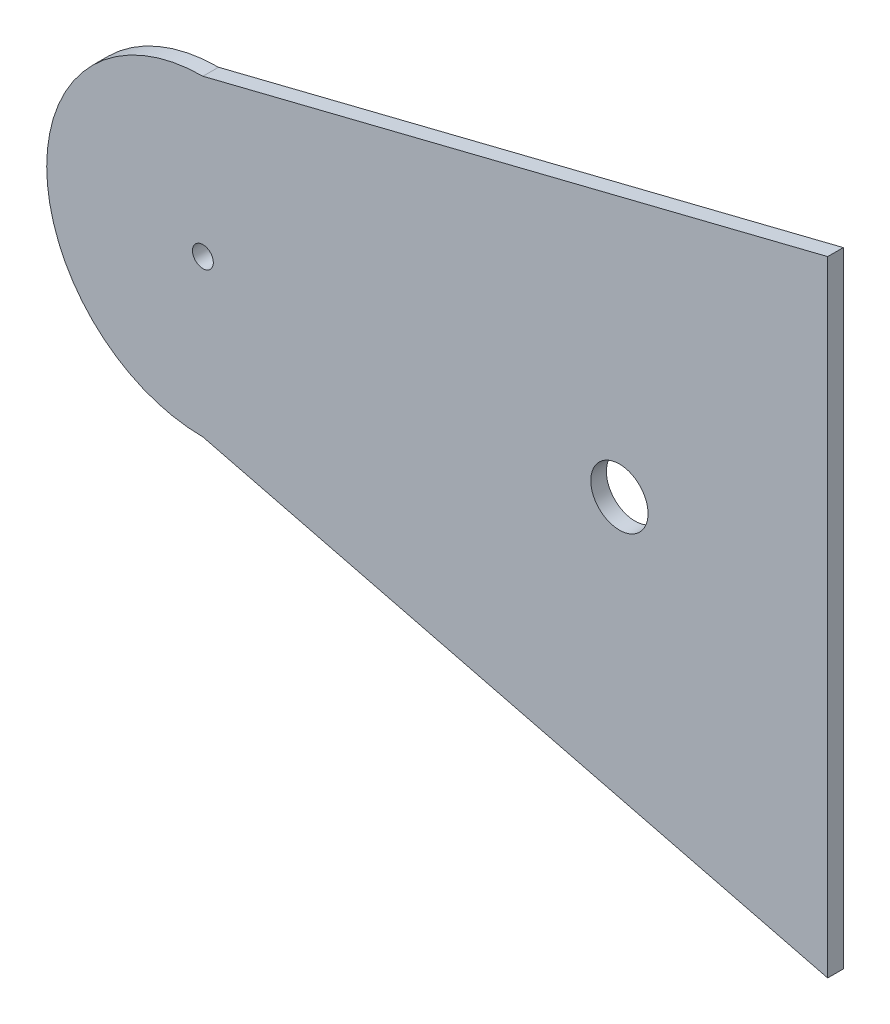
from build123d import *

# Parameters (mm, degrees)
SKETCH_1_R      = 2
SKETCH_1_R_2    = 5.5
EXTRUDE_1_DEPTH = 3


with BuildPart() as part:
    # 草图1 → 凸台-拉伸1 (new body)
    with BuildSketch(Plane.XY):
        with BuildLine():
            Line((174.002581869, 43.707860978), (294.002581869, 73.707860978))
            Line((294.002581869, 73.707860978), (294.002581869, 13.707860978))
            Line((294.002581869, 13.707860978), (294.002581869, -46.292139022))
            Line((294.002581869, -46.292139022), (174.002581869, -16.292139022))
            ThreePointArc((174.002581869, -16.292139022), (144.002581869, 13.707860978), (174.002581869, 43.707860978))
        make_face()
        with Locations((174.002581869, 13.707860978)):
            Circle(SKETCH_1_R, mode=Mode.SUBTRACT)
        with Locations((254.002581869, 13.707860978)):
            Circle(SKETCH_1_R_2, mode=Mode.SUBTRACT)
    extrude(amount=EXTRUDE_1_DEPTH)


solid = part.part
